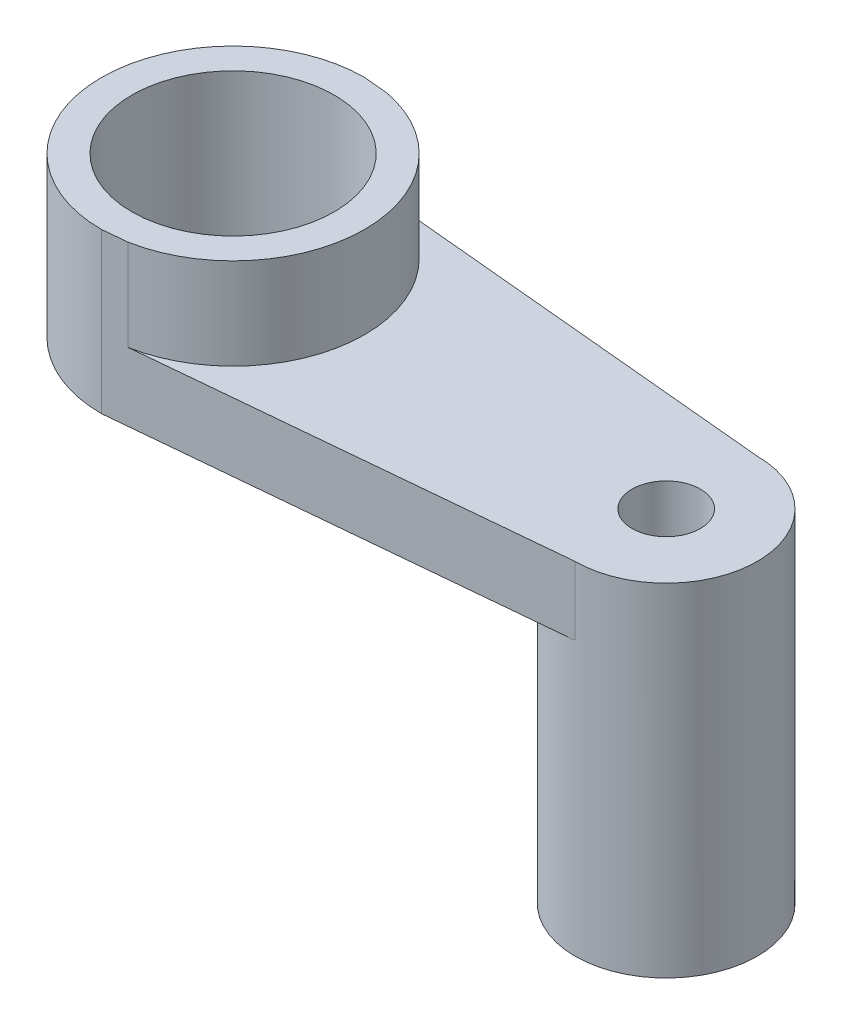
from build123d import *

# Parameters (mm, degrees)
SKETCH2_R           = 8.88072163
BOSS_EXTRUDE3_DEPTH = 14
SKETCH2_4_R         = 3
BOSS_EXTRUDE4_DEPTH = 24
SKETCH2_5_R         = 3
BOSS_EXTRUDE5_DEPTH = 6


with BuildPart() as part:
    # Sketch2 → Boss-Extrude3 (new body)
    with BuildSketch(Plane(origin=(0, 0, 0), x_dir=(1, 0, 0), z_dir=(0, 1, 0))):
        with BuildLine():
            Line((-36.813210299, 19.828534504), (-38.952982558, 20.028563155))
            ThreePointArc((-38.952982558, 20.028563155), (-50.497920677, 8.483625036), (-38.952982558, -3.061313083))
            Line((-38.952982558, -3.061313083), (-36.813210299, -2.861284433))
            ThreePointArc((-36.813210299, -2.861284433), (-30.065093762, 1.115380406), (-27.408044439, 8.483625036))
            ThreePointArc((-27.408044439, 8.483625036), (-30.065093762, 15.851869666), (-36.813210299, 19.828534504))
        make_face()
        with Locations((-38.952982558, 8.483625036)):
            Circle(SKETCH2_R, mode=Mode.SUBTRACT)
    extrude(amount=BOSS_EXTRUDE3_DEPTH)



with BuildPart() as body_2:
    # Sketch2<4> → Boss-Extrude4 (new body)
    with BuildSketch(Plane(origin=(0, 0, 0), x_dir=(1, 0, 0), z_dir=(0, 1, 0))):
        with BuildLine():
            ThreePointArc((7.039666909, 8.483625036), (4.69867408, 14.135281673), (-0.952982558, 16.476274503))
            ThreePointArc((-0.952982558, 16.476274503), (-8.945632025, 8.483625036), (-0.952982558, 0.490975569))
            ThreePointArc((-0.952982558, 0.490975569), (4.69867408, 2.831968398), (7.039666909, 8.483625036))
        make_face()
        with Locations((-0.952982558, 8.483625036)):
            Circle(SKETCH2_4_R, mode=Mode.SUBTRACT)
    extrude(amount=-BOSS_EXTRUDE4_DEPTH)


with BuildPart() as part_1:
    add(part.part)

    add(body_2.part)  # Boss-Extrude5 merges body 2
    # Sketch2<5> → Boss-Extrude5 (add)
    with BuildSketch(Plane(origin=(0, 0, 0), x_dir=(1, 0, 0), z_dir=(0, 1, 0))):
        with BuildLine():
            Line((-0.952982558, 16.476274503), (-36.813210299, 19.828534504))
            ThreePointArc((-36.813210299, 19.828534504), (-27.408044439, 8.483625036), (-36.813210299, -2.861284433))
            Line((-36.813210299, -2.861284433), (-0.952982558, 0.490975569))
            ThreePointArc((-0.952982558, 0.490975569), (7.039666909, 8.483625036), (-0.952982558, 16.476274503))
        make_face()
        with Locations((-0.952982558, 8.483625036)):
            Circle(SKETCH2_5_R, mode=Mode.SUBTRACT)
    extrude(amount=BOSS_EXTRUDE5_DEPTH)


solid = part_1.part
